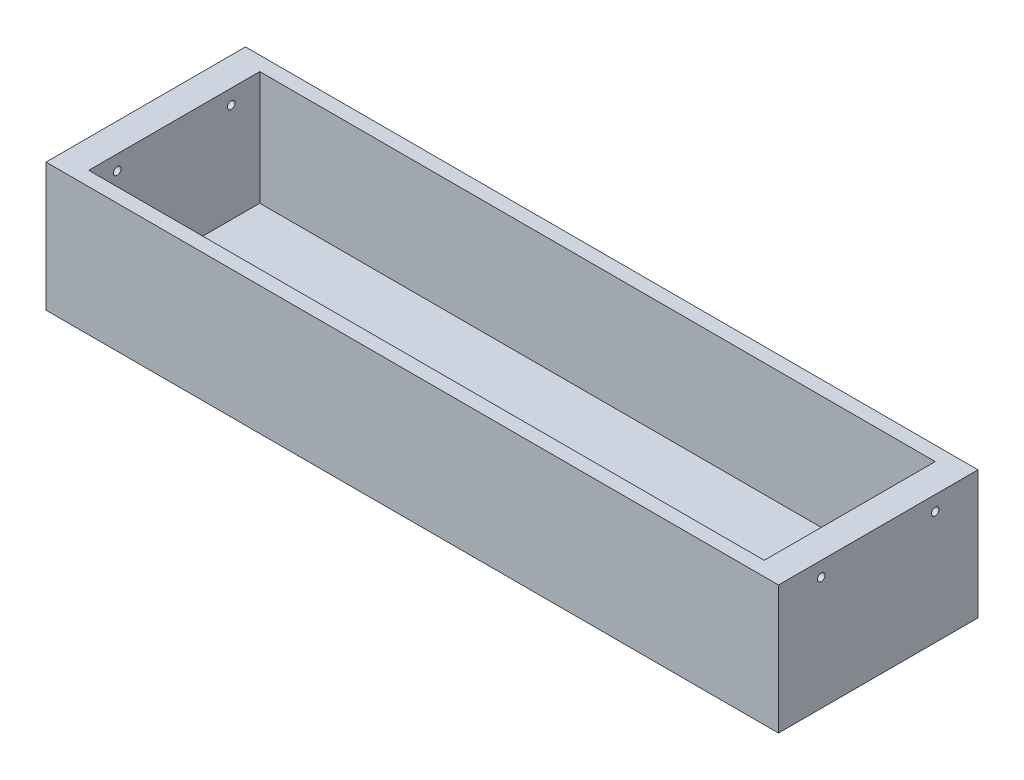
from build123d import *

# Parameters (mm, degrees)
SKETCH1_W           = 326.39
SKETCH1_H           = 88.9
SKETCH1_W_2         = 300.99
SKETCH1_H_2         = 76.2
BOSS_EXTRUDE1_DEPTH = 50.8
SKETCH2_W           = 326.39
SKETCH2_H           = 88.9
BOSS_EXTRUDE2_DEPTH = 6.35
SKETCH3_R           = 3.1
CUT_EXTRUDE1_DEPTH  = 179.534402917
SKETCH4_R           = 1.6875
CUT_EXTRUDE3_DEPTH  = 313.69


with BuildPart() as part:
    # Sketch1 → Boss-Extrude1 (new body)
    with BuildSketch(Plane(origin=(0, 0, 0), x_dir=(1, 0, 0), z_dir=(0, 1, 0))):
        Rectangle(SKETCH1_W, SKETCH1_H)
        Rectangle(SKETCH1_W_2, SKETCH1_H_2, mode=Mode.SUBTRACT)
    extrude(amount=BOSS_EXTRUDE1_DEPTH)

    # Sketch2 → Boss-Extrude2 (add)
    with BuildSketch(Plane.XZ):
        Rectangle(SKETCH2_W, SKETCH2_H)
    extrude(amount=BOSS_EXTRUDE2_DEPTH)

    # Sketch3 → Cut-Extrude1 (cut, through all)
    with BuildSketch(Plane.XZ.offset(6.35)):
        with Locations(Location((-106, 7.5, 0), (0, 0, 270))):
            Circle(SKETCH3_R)
        with Locations(Location((-106, -7.5, 0), (0, 0, 270))):
            Circle(SKETCH3_R)
    extrude(amount=-CUT_EXTRUDE1_DEPTH, mode=Mode.SUBTRACT)

    # Sketch4 → Cut-Extrude3 (cut)
    with BuildSketch(Plane(origin=(163.195, 0, 0), x_dir=(0, 0, -1), z_dir=(1, 0, 0))):
        with Locations((25.4, 44.22394)):
            Circle(SKETCH4_R)
        with Locations(Location((-25.4, 44.22394, 0), (0, 0, 180))):
            Circle(SKETCH4_R)
    cut_extrude3 = extrude(amount=-CUT_EXTRUDE3_DEPTH, mode=Mode.SUBTRACT)

    # Mirror2: Cut-Extrude3 across plane
    add(cut_extrude3.mirror(Plane(origin=(0, 0, 0), x_dir=(0, 0, 1), z_dir=(1, 0, 0))), mode=Mode.SUBTRACT)


solid = part.part
